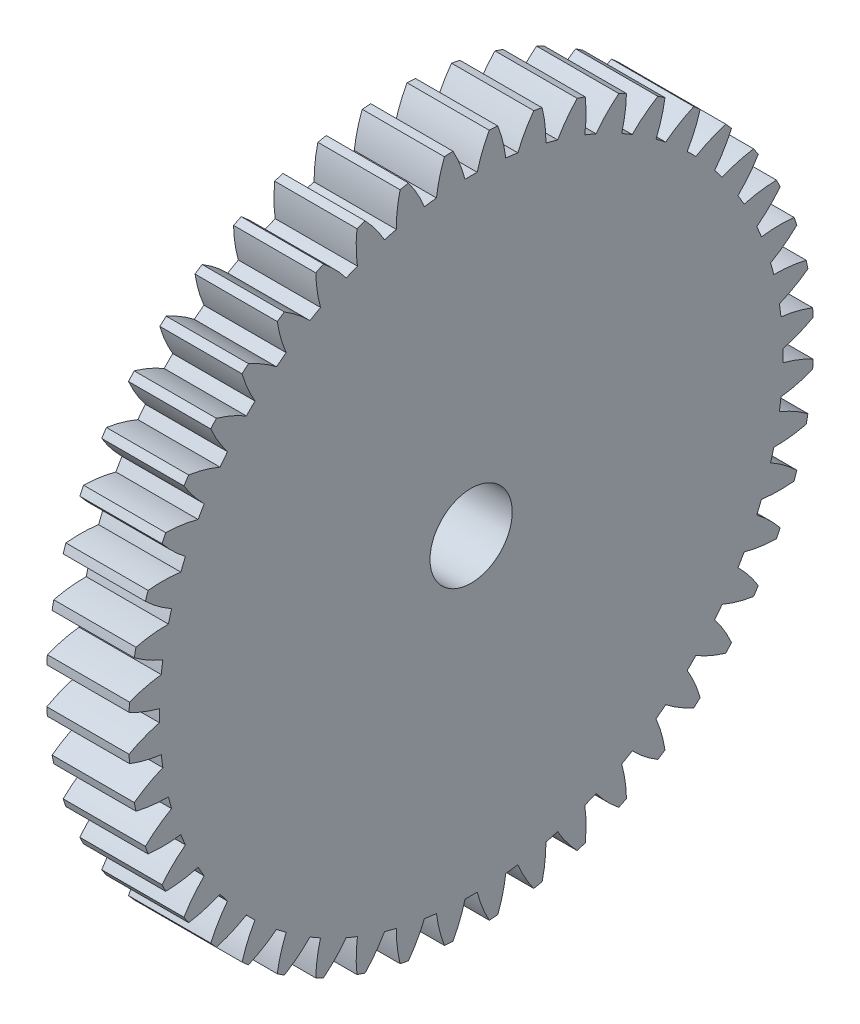
from build123d import *

# Parameters (mm, degrees)
BASPROSKE_W     = 6.35
BASPROSKE_H     = 26.458333333
TOOTHCUT_DEPTH  = 38.952724613
TEETHCUTS_COUNT = 48
TEETHCUTS_ANGLE = 352.5
BORSKE_R        = 3.175
BORE_DEPTH      = 50.8000508


with BuildPart() as part:
    # BasProSke → Base-Revolve (revolve)
    with BuildSketch(Plane(origin=(0, 0, 0), x_dir=(1, 0, 0), z_dir=(0, 1, 0)), mode=Mode.PRIVATE) as base_revolve_sk:
        with Locations((3.175, 13.229166667)):
            Rectangle(BASPROSKE_W, BASPROSKE_H)
    revolve(base_revolve_sk.sketch.rotate(Axis((-10, 0, 0), (1, 0, 0)), 180), axis=Axis((-10, 0, 0), (1, 0, 0)))

    # TooCutSke → ToothCut (cut, through all)
    with BuildSketch(Plane(origin=(0, 0, 0), x_dir=(0, 0, -1), z_dir=(1, 0, 0))):
        with BuildLine():
            ThreePointArc((0.470049195, 24.074611656), (0, 24.0792), (-0.470049195, 24.074611656))
            ThreePointArc((-0.470049195, 24.074611656), (-0.867811068, 25.290054078), (-1.415110271, 26.445899383))
            ThreePointArc((-1.415110271, 26.445899383), (0, 26.483733333), (1.415110271, 26.445899383))
            ThreePointArc((1.415110271, 26.445899383), (0.867811068, 25.290054078), (0.470049195, 24.074611656))
        make_face()
    toothcut = extrude(amount=TOOTHCUT_DEPTH, mode=Mode.SUBTRACT)

    # TeethCuts: ToothCut ×48 about axis
    teethcuts_axis = Axis((-10, 0, 0), (1, 0, 0))
    for i in range(1, TEETHCUTS_COUNT):
        add(toothcut.rotate(teethcuts_axis, i * TEETHCUTS_ANGLE / (TEETHCUTS_COUNT - 1)), mode=Mode.SUBTRACT)

    # BorSke → Bore (cut, symmetric)
    with BuildSketch(Plane(origin=(0, 0, 0), x_dir=(0, 0, -1), z_dir=(1, 0, 0))):
        with Locations(Location((0, 0, 0), (0, 0, 180))):
            Circle(BORSKE_R)
    extrude(amount=BORE_DEPTH, both=True, mode=Mode.SUBTRACT)


solid = part.part
